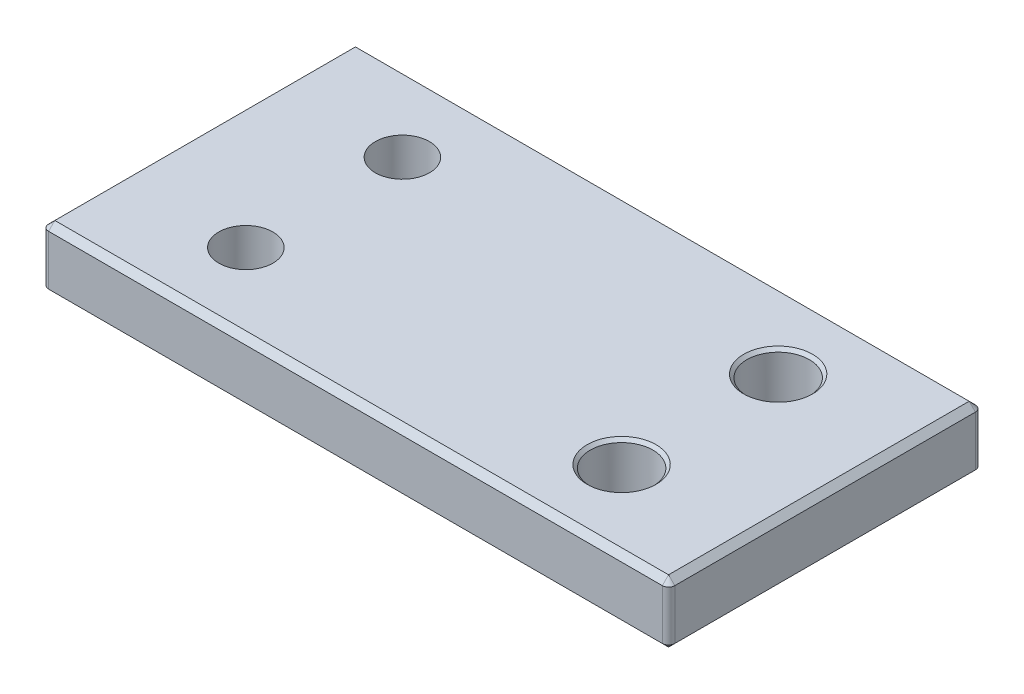
from build123d import *

# Parameters (mm, degrees)
SKETCH_1_W          = 100
SKETCH_1_H          = 50
EXTRUDE_1_DEPTH     = 10
SKETCH_2_R          = 5
EXTRUDE_2_DEPTH     = 10
HOLE_WIZARD_1_D     = 8.647
HOLE_WIZARD_1_DEPTH = 26.2
HOLE_WIZARD_1_TIP   = 2.597820886
FILLET_3_R          = 1
CHAMFER_2_SIZE      = 1
CHAMFER_3_SIZE      = 0.5


with BuildPart() as part:
    # 草圖1 → 擠出1 (new body)
    with BuildSketch(Plane(origin=(0, 0, 0), x_dir=(-1, 0, 0), z_dir=(0, 1, 0))):
        Rectangle(SKETCH_1_W, SKETCH_1_H)
    extrude(amount=EXTRUDE_1_DEPTH)

    # 草圖2 → 擠出2 (cut)
    with BuildSketch(Plane(origin=(0, 10, 0), x_dir=(-1, 0, 0), z_dir=(0, 1, 0))):
        with Locations(Location((-30, -12.5, 0), (0, 0, 90))):
            Circle(SKETCH_2_R)
        with Locations(Location((-30, 12.5, 0), (0, 0, 90))):
            Circle(SKETCH_2_R)
    extrude(amount=-EXTRUDE_2_DEPTH, mode=Mode.SUBTRACT)

    # 孔1
    with Locations(Plane(origin=(0, 10, 0), x_dir=(1, 0, 0), z_dir=(0, 1, 0))):
        with Locations((-30, -12.5), (-30, 12.5)):
            Hole(HOLE_WIZARD_1_D / 2, depth=HOLE_WIZARD_1_DEPTH)
            with Locations((0, 0, -(HOLE_WIZARD_1_DEPTH + HOLE_WIZARD_1_TIP / 2))):  # 118° drill point
                Cone(0, HOLE_WIZARD_1_D / 2, HOLE_WIZARD_1_TIP, mode=Mode.SUBTRACT)

    # 圓角3
    fillet_3_edges = [part.edges().sort_by_distance(p)[0] for p in [
        (-50, 5, -25),
        (50, 5, -25),
        (50, 5, 25),
        (-50, 5, 25),
    ]]
    fillet(fillet_3_edges, radius=FILLET_3_R)

    # 倒角2
    chamfer_2_edges = [part.edges().sort_by_distance(p)[0] for p in [
        (0, 0, -25),
        (0, 10, -25),
        (-50, 0, 0),
        (50, 0, 0),
        (0, 0, 25),
        (-49.707106781, 0, 24.707106781),
        (-49.707106781, 0, -24.707106781),
        (49.707106781, 0, 24.707106781),
        (49.707106781, 0, -24.707106781),
        (50, 10, 0),
        (-50, 10, 0),
        (0, 10, 25),
        (-49.707106781, 10, 24.707106781),
        (-49.707106781, 10, -24.707106781),
        (49.707106781, 10, 24.707106781),
        (49.707106781, 10, -24.707106781),
    ]]
    chamfer(chamfer_2_edges, length=CHAMFER_2_SIZE)

    # 倒角3
    chamfer_3_edges = [part.edges().sort_by_distance(p)[0] for p in [
        (30, 10, -17.5),
        (30, 10, 7.5),
    ]]
    chamfer(chamfer_3_edges, length=CHAMFER_3_SIZE)


solid = part.part
